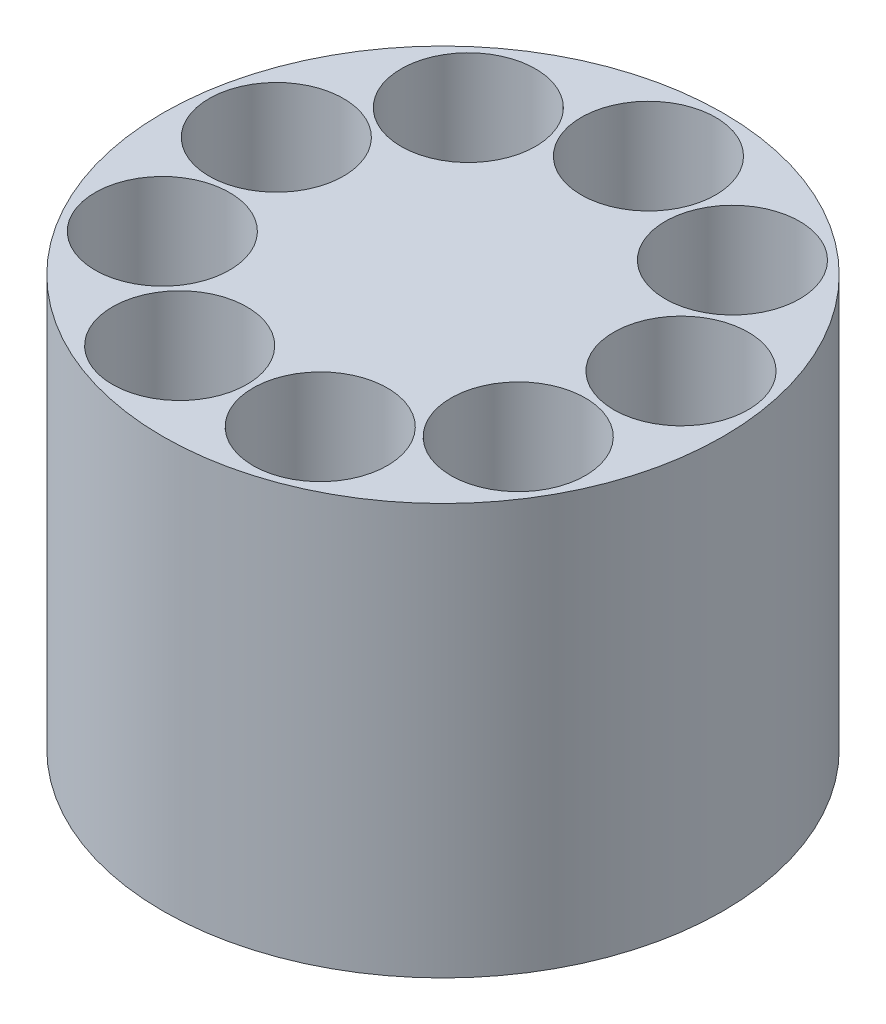
from build123d import *

# Parameters (mm, degrees)
SKETCH_1_R      = 150
SKETCH_1_R_2    = 36
EXTRUDE_1_DEPTH = 220
EXTRUDE_START   = -10
SKETCH_2_R      = 12.5
EXTRUDE_2_DEPTH = 10


with BuildPart() as part:
    # 草圖1 → 填料-伸長1 (new body)
    with BuildSketch(Plane(origin=(0, 0, 0), x_dir=(1, 0, 0), z_dir=(0, 1, 0))):
        with Locations(Location((0, 0, 0), (0, 0, 270))):
            Circle(SKETCH_1_R)
        with Locations(Location((0, 110, 0), (0, 0, 270))):
            Circle(SKETCH_1_R_2, mode=Mode.SUBTRACT)
        with Locations(Location((70.706637066, 84.264888743, 0), (0, 0, 270))):
            Circle(SKETCH_1_R_2, mode=Mode.SUBTRACT)
        with Locations(Location((108.328852831, 19.101299543, 0), (0, 0, 270))):
            Circle(SKETCH_1_R_2, mode=Mode.SUBTRACT)
        with Locations(Location((95.262794416, -55, 0), (0, 0, 270))):
            Circle(SKETCH_1_R_2, mode=Mode.SUBTRACT)
        with Locations(Location((37.622215766, -103.366188286, 0), (0, 0, 270))):
            Circle(SKETCH_1_R_2, mode=Mode.SUBTRACT)
        with Locations(Location((-37.622215766, -103.366188286, 0), (0, 0, 270))):
            Circle(SKETCH_1_R_2, mode=Mode.SUBTRACT)
        with Locations(Location((-95.262794416, -55, 0), (0, 0, 270))):
            Circle(SKETCH_1_R_2, mode=Mode.SUBTRACT)
        with Locations(Location((-108.328852831, 19.101299543, 0), (0, 0, 270))):
            Circle(SKETCH_1_R_2, mode=Mode.SUBTRACT)
        with Locations(Location((-70.706637066, 84.264888743, 0), (0, 0, 270))):
            Circle(SKETCH_1_R_2, mode=Mode.SUBTRACT)
        with BuildLine():
            ThreePointArc((12.247448714, 2.5), (-12.5, 0), (12.247448714, -2.5))
            ThreePointArc((12.247448714, -2.5), (12.5, 0), (12.247448714, 2.5))
        make_face(mode=Mode.SUBTRACT)
    extrude(amount=EXTRUDE_1_DEPTH)

    # 草圖2 → 填料-伸長2 (add)
    with BuildSketch(Plane(origin=(0, 220, 0), x_dir=(1, 0, 0), z_dir=(0, 1, 0)).offset(EXTRUDE_START)):
        with Locations(Location((0, 0, 0), (0, 0, 270))):
            Circle(SKETCH_2_R)
    extrude(amount=EXTRUDE_2_DEPTH)


solid = part.part
